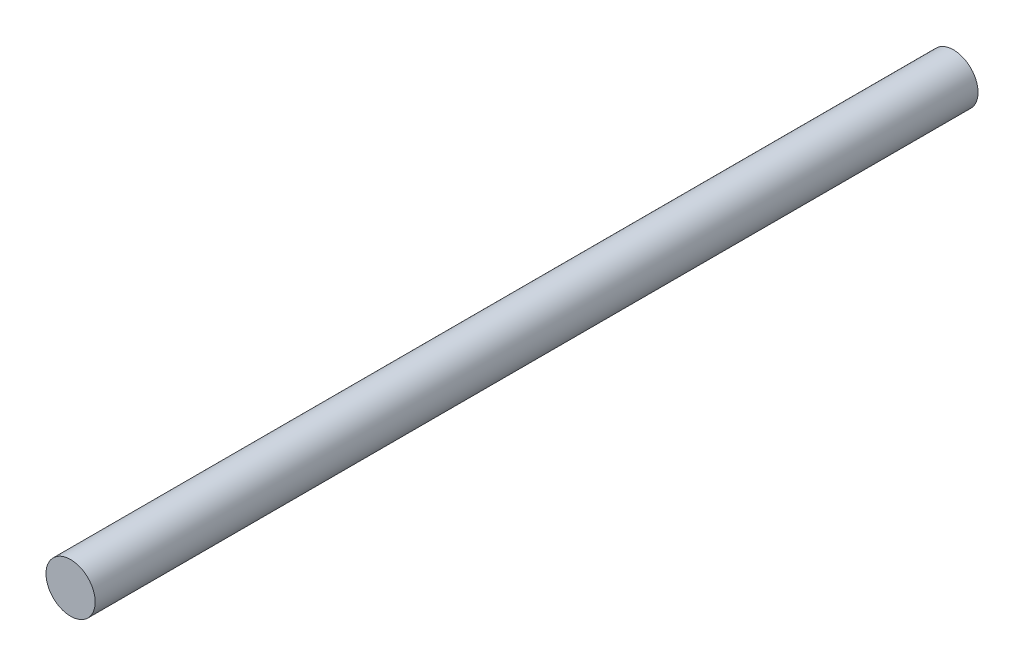
from build123d import *

# Parameters (mm, degrees)
SKETCH1_R           = 1.5875
BOSS_EXTRUDE1_DEPTH = 57


with BuildPart() as part:
    # Sketch1 → Boss-Extrude1 (new body)
    with BuildSketch(Plane.XY):
        with Locations(Location((0, 0, 0), (0, 0, 180))):
            Circle(SKETCH1_R)
    extrude(amount=BOSS_EXTRUDE1_DEPTH)


solid = part.part
